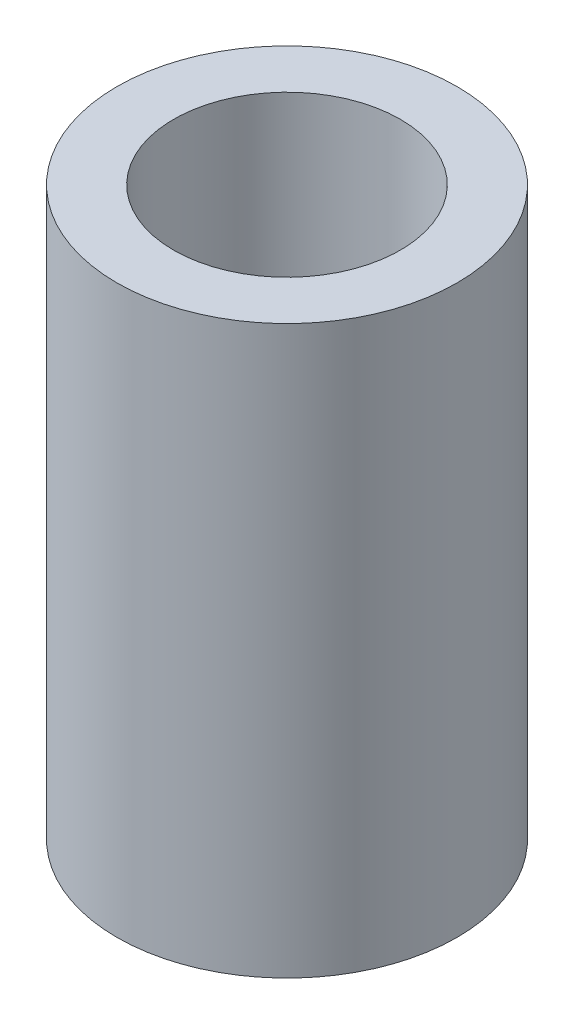
from build123d import *

# Parameters (mm, degrees)
SKETCH_1_R      = 3
SKETCH_1_R_2    = 2
EXTRUDE_1_DEPTH = 10


with BuildPart() as part:
    # 草图1 → 凸台-拉伸1 (new body)
    with BuildSketch(Plane(origin=(0, 0, 0), x_dir=(1, 0, 0), z_dir=(0, 1, 0))):
        with Locations(Location((0, 0, 0), (0, 0, 270))):
            Circle(SKETCH_1_R)
        with Locations(Location((0, 0, 0), (0, 0, 270))):
            Circle(SKETCH_1_R_2, mode=Mode.SUBTRACT)
    extrude(amount=EXTRUDE_1_DEPTH)


solid = part.part
